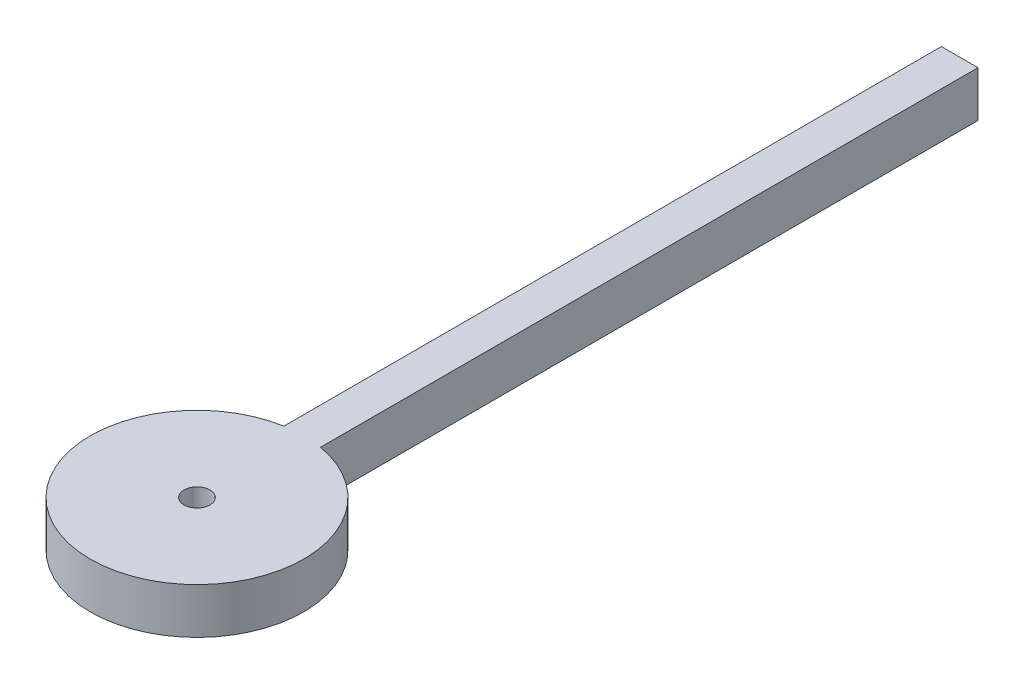
from build123d import *

# Parameters (mm, degrees)
BOSS_EXTRUDE1_DEPTH = 0.3
SKETCH3_R           = 0.085
CUT_EXTRUDE1_DEPTH  = 0.3


with BuildPart() as part:
    # Sketch2 → Boss-Extrude1 (new body)
    with BuildSketch(Plane(origin=(0, 0, 0), x_dir=(1, 0, 0), z_dir=(0, 1, 0))):
        with BuildLine():
            Line((0.12, 0.689637586), (0.12, 5))
            Line((0.12, 5), (-0.12, 5))
            Line((-0.12, 5), (-0.12, 0.689637586))
            ThreePointArc((-0.12, 0.689637586), (0, -0.7), (0.12, 0.689637586))
        make_face()
    extrude(amount=BOSS_EXTRUDE1_DEPTH)

    # Sketch3 → Cut-Extrude1 (cut)
    with BuildSketch(Plane(origin=(0, 0.3, 0), x_dir=(1, 0, 0), z_dir=(0, 1, 0))):
        with Locations(Location((0, 0, 0), (0, 0, 270))):
            Circle(SKETCH3_R)
    extrude(amount=-CUT_EXTRUDE1_DEPTH, mode=Mode.SUBTRACT)


solid = part.part
